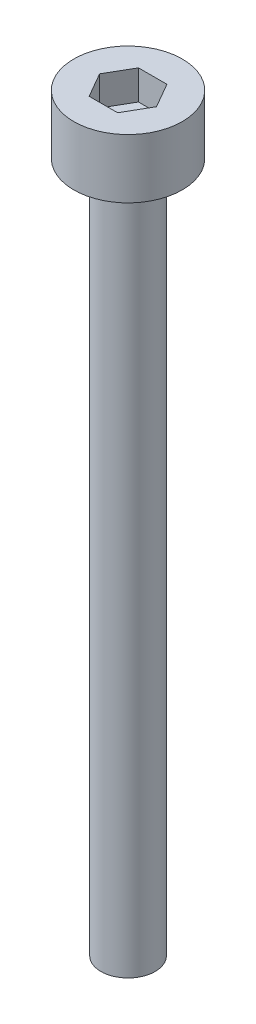
from build123d import *

# Parameters (mm, degrees)
CUT_EXTRUDE1_DEPTH = 1.5


with BuildPart() as part:
    # Sketch1 → Revolve1 (revolve)
    with BuildSketch(Plane.XY, mode=Mode.PRIVATE) as revolve1_sk:
        Polygon((0, 3), (-2.75, 3), (-2.75, 0), (-1.375, 0), (-1.375, -35), (0, -35), align=None)
    revolve(revolve1_sk.sketch.rotate(Axis((0, -35, 0), (0, 1, 0)), 180), axis=Axis((0, -35, 0), (0, 1, 0)))

    # Sketch2 → Cut-Extrude1 (cut)
    with BuildSketch(Plane(origin=(0, 3, 0), x_dir=(1, 0, 0), z_dir=(0, 1, 0))):
        Polygon((0.721687836, -1.25), (1.443375673, 0), (0.721687836, 1.25), (-0.721687836, 1.25), (-1.443375673, 0), (-0.721687836, -1.25), align=None)
    extrude(amount=-CUT_EXTRUDE1_DEPTH, mode=Mode.SUBTRACT)


solid = part.part
